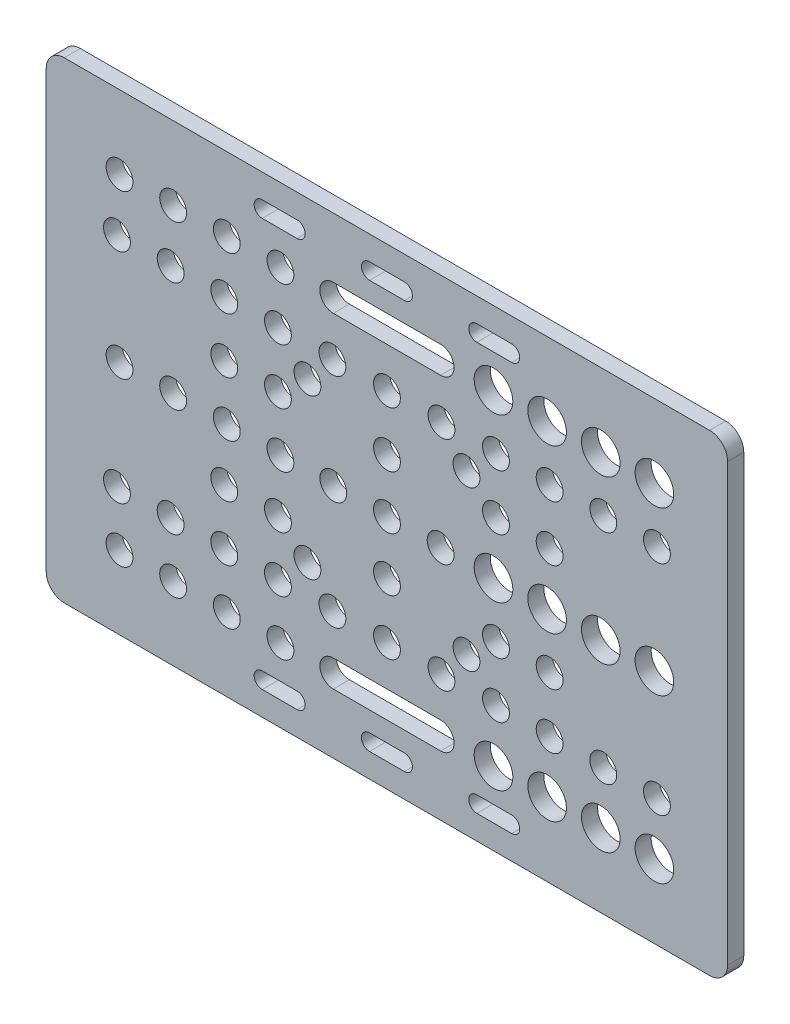
from build123d import *

# Parameters (mm, degrees)
SKETCH1_R           = 2.5
SKETCH1_R_2         = 3.6
BOSS_EXTRUDE1_DEPTH = 3


with BuildPart() as part:
    # Sketch1 → Boss-Extrude1 (new body)
    with BuildSketch(Plane.XY):
        with BuildLine():
            Line((-60.14, -44), (60.14, -44))
            ThreePointArc((60.14, -44), (62.515878785, -43.015878785), (63.5, -40.64))
            Line((63.5, -40.64), (63.5, 40.64))
            ThreePointArc((63.5, 40.64), (62.515878785, 43.015878785), (60.14, 44))
            Line((60.14, 44), (-60.14, 44))
            ThreePointArc((-60.14, 44), (-62.515878785, 43.015878785), (-63.5, 40.64))
            Line((-63.5, 40.64), (-63.5, -40.64))
            ThreePointArc((-63.5, -40.64), (-62.515878785, -43.015878785), (-60.14, -44))
        make_face()
        Circle(SKETCH1_R, mode=Mode.SUBTRACT)
        with Locations((-49.845, 0)):
            Circle(SKETCH1_R, mode=Mode.SUBTRACT)
        with Locations(Location((49.845, 0, 0), (0, 0, 180))):
            Circle(SKETCH1_R_2, mode=Mode.SUBTRACT)
        with Locations((-19.855, -30.32)):
            Circle(SKETCH1_R, mode=Mode.SUBTRACT)
        with Locations(Location((19.855, -30.32, 0), (0, 0, 180))):
            Circle(SKETCH1_R_2, mode=Mode.SUBTRACT)
        with Locations((-29.85, -30.32)):
            Circle(SKETCH1_R, mode=Mode.SUBTRACT)
        with Locations((-39.85, -30.32)):
            Circle(SKETCH1_R, mode=Mode.SUBTRACT)
        with Locations((-49.845, -30.32)):
            Circle(SKETCH1_R, mode=Mode.SUBTRACT)
        with Locations(Location((49.845, -30.32, 0), (0, 0, 180))):
            Circle(SKETCH1_R_2, mode=Mode.SUBTRACT)
        with Locations(Location((39.85, -30.32, 0), (0, 0, 180))):
            Circle(SKETCH1_R_2, mode=Mode.SUBTRACT)
        with Locations(Location((29.85, -30.32, 0), (0, 0, 180))):
            Circle(SKETCH1_R_2, mode=Mode.SUBTRACT)
        with Locations((49.845, 30.32)):
            Circle(SKETCH1_R_2, mode=Mode.SUBTRACT)
        with Locations((39.85, 30.32)):
            Circle(SKETCH1_R_2, mode=Mode.SUBTRACT)
        with Locations((29.85, 30.32)):
            Circle(SKETCH1_R_2, mode=Mode.SUBTRACT)
        with Locations((19.855, 30.32)):
            Circle(SKETCH1_R_2, mode=Mode.SUBTRACT)
        with Locations(Location((-19.855, 30.32, 0), (0, 0, 180))):
            Circle(SKETCH1_R, mode=Mode.SUBTRACT)
        with Locations(Location((-29.85, 30.32, 0), (0, 0, 180))):
            Circle(SKETCH1_R, mode=Mode.SUBTRACT)
        with Locations(Location((-39.85, 30.32, 0), (0, 0, 180))):
            Circle(SKETCH1_R, mode=Mode.SUBTRACT)
        with Locations(Location((-49.845, 30.32, 0), (0, 0, 180))):
            Circle(SKETCH1_R, mode=Mode.SUBTRACT)
        with Locations((-50.32, -20.32)):
            Circle(SKETCH1_R, mode=Mode.SUBTRACT)
        with Locations((-40.32, -20.32)):
            Circle(SKETCH1_R, mode=Mode.SUBTRACT)
        with Locations((-30.32, -20.32)):
            Circle(SKETCH1_R, mode=Mode.SUBTRACT)
        with Locations((-20.32, -20.32)):
            Circle(SKETCH1_R, mode=Mode.SUBTRACT)
        with Locations(Location((50.32, -20.32, 0), (0, 0, 180))):
            Circle(SKETCH1_R, mode=Mode.SUBTRACT)
        with Locations(Location((40.32, -20.32, 0), (0, 0, 180))):
            Circle(SKETCH1_R, mode=Mode.SUBTRACT)
        with Locations(Location((30.32, -20.32, 0), (0, 0, 180))):
            Circle(SKETCH1_R, mode=Mode.SUBTRACT)
        with Locations(Location((20.32, -20.32, 0), (0, 0, 180))):
            Circle(SKETCH1_R, mode=Mode.SUBTRACT)
        with Locations((50.32, 20.32)):
            Circle(SKETCH1_R, mode=Mode.SUBTRACT)
        with Locations((40.32, 20.32)):
            Circle(SKETCH1_R, mode=Mode.SUBTRACT)
        with Locations((30.32, 20.32)):
            Circle(SKETCH1_R, mode=Mode.SUBTRACT)
        with Locations((20.32, 20.32)):
            Circle(SKETCH1_R, mode=Mode.SUBTRACT)
        with Locations(Location((-20.32, 20.32, 0), (0, 0, 180))):
            Circle(SKETCH1_R, mode=Mode.SUBTRACT)
        with Locations(Location((-30.32, 20.32, 0), (0, 0, 180))):
            Circle(SKETCH1_R, mode=Mode.SUBTRACT)
        with Locations(Location((-40.32, 20.32, 0), (0, 0, 180))):
            Circle(SKETCH1_R, mode=Mode.SUBTRACT)
        with Locations(Location((-50.32, 20.32, 0), (0, 0, 180))):
            Circle(SKETCH1_R, mode=Mode.SUBTRACT)
        with Locations((-39.85, 0)):
            Circle(SKETCH1_R, mode=Mode.SUBTRACT)
        with Locations((-29.85, 0)):
            Circle(SKETCH1_R, mode=Mode.SUBTRACT)
        with Locations((-19.855, 0)):
            Circle(SKETCH1_R, mode=Mode.SUBTRACT)
        with Locations(Location((39.85, 0, 0), (0, 0, 180))):
            Circle(SKETCH1_R_2, mode=Mode.SUBTRACT)
        with Locations(Location((29.85, 0, 0), (0, 0, 180))):
            Circle(SKETCH1_R_2, mode=Mode.SUBTRACT)
        with Locations(Location((19.855, 0, 0), (0, 0, 180))):
            Circle(SKETCH1_R_2, mode=Mode.SUBTRACT)
        with Locations((0, -20.32)):
            Circle(SKETCH1_R, mode=Mode.SUBTRACT)
        with Locations(Location((0, 20.32, 0), (0, 0, 180))):
            Circle(SKETCH1_R, mode=Mode.SUBTRACT)
        with Locations((-10.16, -20.32)):
            Circle(SKETCH1_R, mode=Mode.SUBTRACT)
        with Locations(Location((10.16, -20.32, 0), (0, 0, 180))):
            Circle(SKETCH1_R, mode=Mode.SUBTRACT)
        with Locations((10.16, 20.32)):
            Circle(SKETCH1_R, mode=Mode.SUBTRACT)
        with Locations(Location((-10.16, 20.32, 0), (0, 0, 180))):
            Circle(SKETCH1_R, mode=Mode.SUBTRACT)
        with Locations((-10, 0)):
            Circle(SKETCH1_R, mode=Mode.SUBTRACT)
        with Locations(Location((10, 0, 0), (0, 0, 180))):
            Circle(SKETCH1_R, mode=Mode.SUBTRACT)
        with Locations((0, -10)):
            Circle(SKETCH1_R, mode=Mode.SUBTRACT)
        with Locations(Location((0, 10, 0), (0, 0, 180))):
            Circle(SKETCH1_R, mode=Mode.SUBTRACT)
        with Locations((-30.32, -10)):
            Circle(SKETCH1_R, mode=Mode.SUBTRACT)
        with Locations((-20.32, -10)):
            Circle(SKETCH1_R, mode=Mode.SUBTRACT)
        with Locations(Location((30.32, -10, 0), (0, 0, 180))):
            Circle(SKETCH1_R, mode=Mode.SUBTRACT)
        with Locations(Location((20.32, -10, 0), (0, 0, 180))):
            Circle(SKETCH1_R, mode=Mode.SUBTRACT)
        with Locations((30.32, 10)):
            Circle(SKETCH1_R, mode=Mode.SUBTRACT)
        with Locations((20.32, 10)):
            Circle(SKETCH1_R, mode=Mode.SUBTRACT)
        with Locations(Location((-30.32, 10, 0), (0, 0, 180))):
            Circle(SKETCH1_R, mode=Mode.SUBTRACT)
        with Locations(Location((-20.32, 10, 0), (0, 0, 180))):
            Circle(SKETCH1_R, mode=Mode.SUBTRACT)
        with Locations((-14.82, -14.82)):
            Circle(SKETCH1_R, mode=Mode.SUBTRACT)
        with Locations(Location((14.82, -14.82, 0), (0, 0, 180))):
            Circle(SKETCH1_R, mode=Mode.SUBTRACT)
        with Locations((14.82, 14.82)):
            Circle(SKETCH1_R, mode=Mode.SUBTRACT)
        with Locations(Location((-14.82, 14.82, 0), (0, 0, 180))):
            Circle(SKETCH1_R, mode=Mode.SUBTRACT)
        with BuildLine():
            Line((-10, -27.82), (10, -27.82))
            ThreePointArc((10, -27.82), (12.5, -30.32), (10, -32.82))
            Line((10, -32.82), (-10, -32.82))
            ThreePointArc((-10, -32.82), (-12.5, -30.32), (-10, -27.82))
        make_face(mode=Mode.SUBTRACT)
        with BuildLine():
            Line((-10, 27.82), (10, 27.82))
            ThreePointArc((10, 27.82), (12.5, 30.32), (10, 32.82))
            Line((10, 32.82), (-10, 32.82))
            ThreePointArc((-10, 32.82), (-12.5, 30.32), (-10, 27.82))
        make_face(mode=Mode.SUBTRACT)
        with BuildLine():
            Line((-3.25, -36.52), (3.25, -36.52))
            ThreePointArc((3.25, -36.52), (4.75, -38.02), (3.25, -39.52))
            Line((3.25, -39.52), (-3.25, -39.52))
            ThreePointArc((-3.25, -39.52), (-4.75, -38.02), (-3.25, -36.52))
        make_face(mode=Mode.SUBTRACT)
        with BuildLine():
            Line((-23.25, -36.52), (-16.75, -36.52))
            ThreePointArc((-16.75, -36.52), (-15.25, -38.02), (-16.75, -39.52))
            Line((-16.75, -39.52), (-23.25, -39.52))
            ThreePointArc((-23.25, -39.52), (-24.75, -38.02), (-23.25, -36.52))
        make_face(mode=Mode.SUBTRACT)
        with BuildLine():
            Line((23.25, -36.52), (16.75, -36.52))
            ThreePointArc((16.75, -36.52), (15.25, -38.02), (16.75, -39.52))
            Line((16.75, -39.52), (23.25, -39.52))
            ThreePointArc((23.25, -39.52), (24.75, -38.02), (23.25, -36.52))
        make_face(mode=Mode.SUBTRACT)
        with BuildLine():
            Line((-23.25, 36.52), (-16.75, 36.52))
            ThreePointArc((-16.75, 36.52), (-15.25, 38.02), (-16.75, 39.52))
            Line((-16.75, 39.52), (-23.25, 39.52))
            ThreePointArc((-23.25, 39.52), (-24.75, 38.02), (-23.25, 36.52))
        make_face(mode=Mode.SUBTRACT)
        with BuildLine():
            Line((-3.25, 36.52), (3.25, 36.52))
            ThreePointArc((3.25, 36.52), (4.75, 38.02), (3.25, 39.52))
            Line((3.25, 39.52), (-3.25, 39.52))
            ThreePointArc((-3.25, 39.52), (-4.75, 38.02), (-3.25, 36.52))
        make_face(mode=Mode.SUBTRACT)
        with BuildLine():
            Line((23.25, 36.52), (16.75, 36.52))
            ThreePointArc((16.75, 36.52), (15.25, 38.02), (16.75, 39.52))
            Line((16.75, 39.52), (23.25, 39.52))
            ThreePointArc((23.25, 39.52), (24.75, 38.02), (23.25, 36.52))
        make_face(mode=Mode.SUBTRACT)
    extrude(amount=BOSS_EXTRUDE1_DEPTH)


solid = part.part
